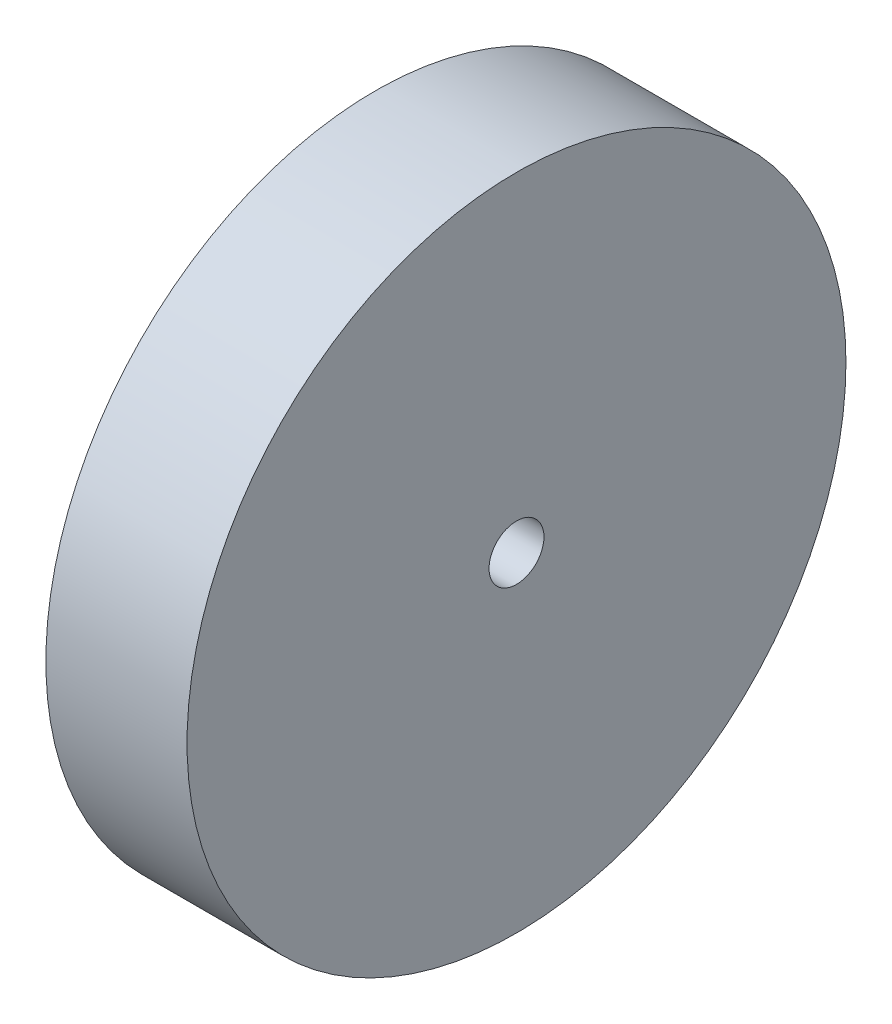
from build123d import *

# Parameters (mm, degrees)
SKETCH1_R           = 35
SKETCH1_R_2         = 2.916666667
BOSS_EXTRUDE1_DEPTH = 15


with BuildPart() as part:
    # Sketch1 → Boss-Extrude1 (new body)
    with BuildSketch(Plane(origin=(0, 0, 0), x_dir=(0, 0, -1), z_dir=(1, 0, 0))):
        Circle(SKETCH1_R)
        Circle(SKETCH1_R_2, mode=Mode.SUBTRACT)
    extrude(amount=BOSS_EXTRUDE1_DEPTH)


solid = part.part
